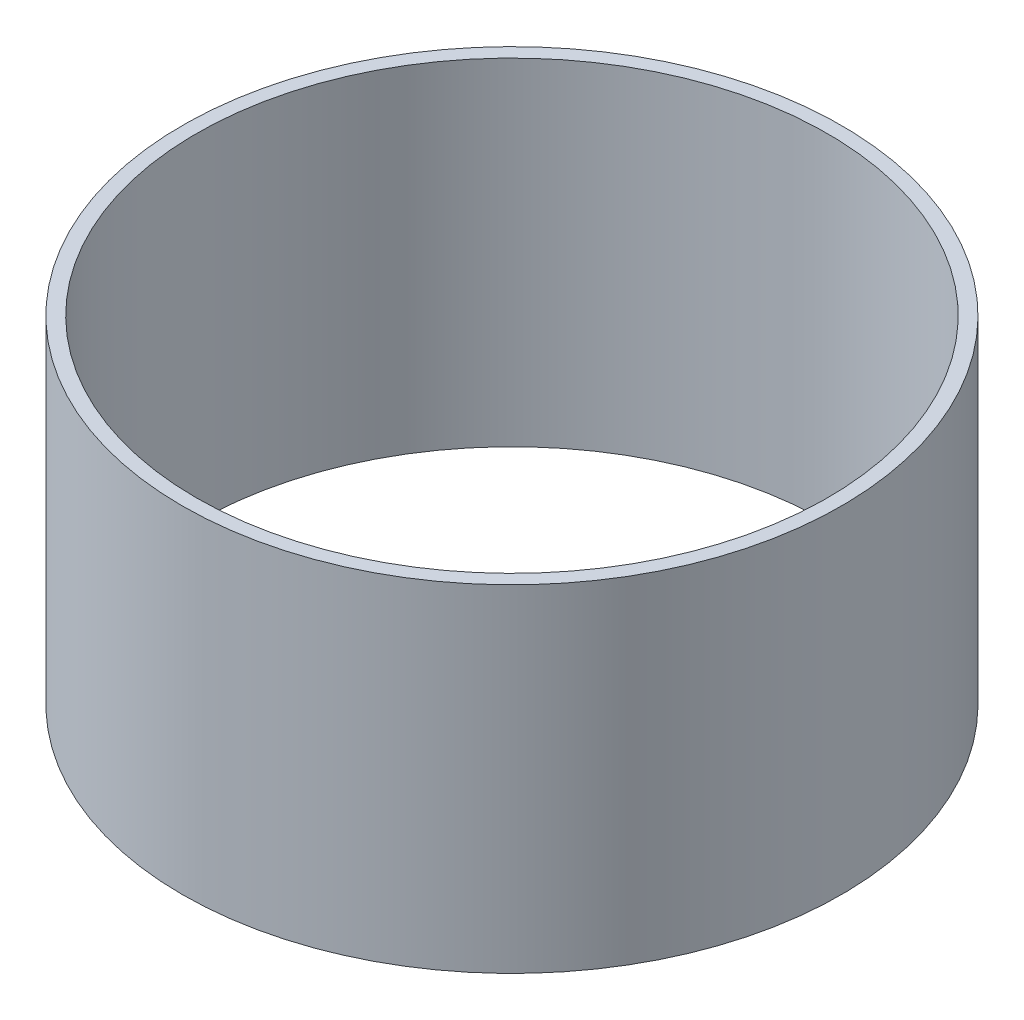
from build123d import *

# Parameters (mm, degrees)
SKETCH1_R           = 298.45
SKETCH1_R_2         = 285.75
BOSS_EXTRUDE1_DEPTH = 304.8


with BuildPart() as part:
    # Sketch1 → Boss-Extrude1 (new body)
    with BuildSketch(Plane(origin=(0, 0, 0), x_dir=(1, 0, 0), z_dir=(0, 1, 0))):
        with Locations(Location((0, 0, 0), (0, 0, 270))):
            Circle(SKETCH1_R)
        with Locations(Location((0, 0, 0), (0, 0, 270))):
            Circle(SKETCH1_R_2, mode=Mode.SUBTRACT)
    extrude(amount=-BOSS_EXTRUDE1_DEPTH)


solid = part.part
